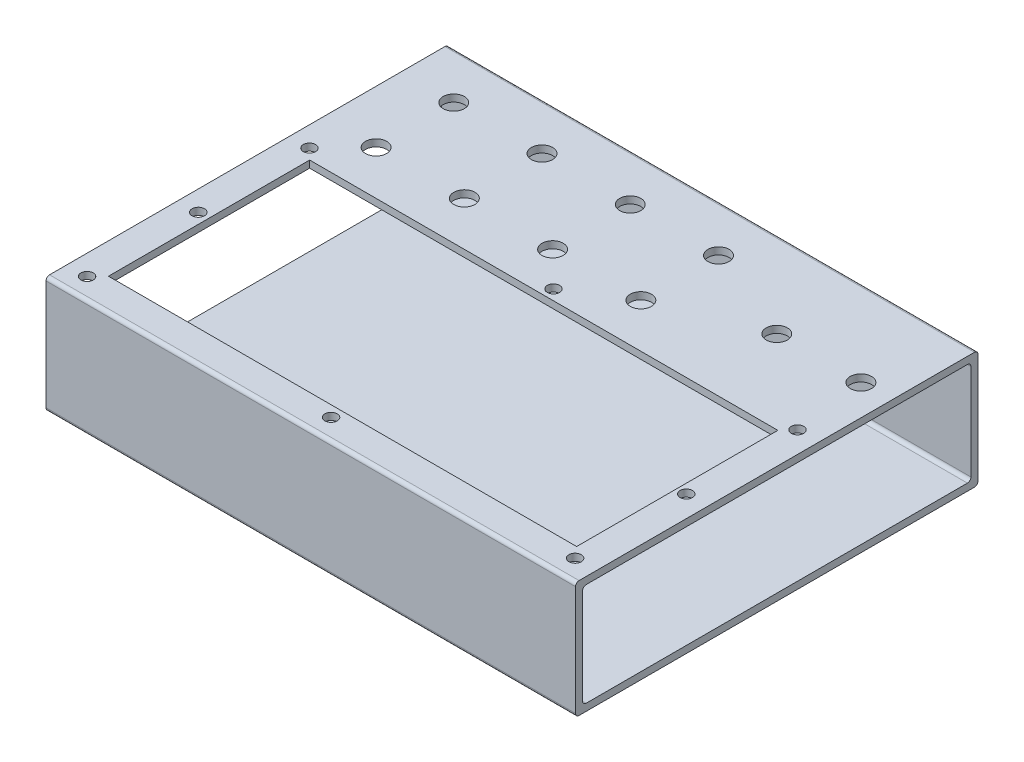
from build123d import *

# Parameters (mm, degrees)
BOSS_EXTRUDE7_DEPTH = 150
CUT_EXTRUDE3_DEPTH  = 150
SKETCH25_W          = 132.62
SKETCH25_H          = 57
CUT_EXTRUDE4_DEPTH  = 2
SKETCH26_R          = 3
SKETCH26_R_2        = 1.75
CUT_EXTRUDE5_DEPTH  = 10


with BuildPart() as part:
    # Sketch23 → Boss-Extrude7 (new body)
    with BuildSketch(Plane(origin=(0, 0, 0), x_dir=(0, 0, -1), z_dir=(1, 0, 0))):
        with BuildLine():
            Line((-56, 16.55), (56, 16.55))
            ThreePointArc((56, 16.55), (56.707106781, 16.257106781), (57, 15.55))
            Line((57, 15.55), (57, -15.55))
            ThreePointArc((57, -15.55), (56.707106781, -16.257106781), (56, -16.55))
            Line((56, -16.55), (-56, -16.55))
            ThreePointArc((-56, -16.55), (-56.707106781, -16.257106781), (-57, -15.55))
            Line((-57, -15.55), (-57, 15.55))
            ThreePointArc((-57, 15.55), (-56.707106781, 16.257106781), (-56, 16.55))
        make_face()
    extrude(amount=BOSS_EXTRUDE7_DEPTH)

    # Sketch24 → Cut-Extrude3 (cut)
    with BuildSketch(Plane.ZY):
        with BuildLine():
            Line((54, -14.55), (-54, -14.55))
            ThreePointArc((-54, -14.55), (-54.707106781, -14.257106781), (-55, -13.55))
            Line((-55, -13.55), (-55, 13.55))
            ThreePointArc((-55, 13.55), (-54.707106781, 14.257106781), (-54, 14.55))
            Line((-54, 14.55), (54, 14.55))
            ThreePointArc((54, 14.55), (54.707106781, 14.257106781), (55, 13.55))
            Line((55, 13.55), (55, -13.55))
            ThreePointArc((55, -13.55), (54.707106781, -14.257106781), (54, -14.55))
        make_face()
    extrude(amount=-CUT_EXTRUDE3_DEPTH, mode=Mode.SUBTRACT)

    # Sketch25 → Cut-Extrude4 (cut)
    with BuildSketch(Plane(origin=(0, 16.55, 0), x_dir=(1, 0, 0), z_dir=(0, 1, 0))):
        with Locations((75, -19.5)):
            Rectangle(SKETCH25_W, SKETCH25_H)
    extrude(amount=-CUT_EXTRUDE4_DEPTH, mode=Mode.SUBTRACT)

    # Sketch26 → Cut-Extrude5 (cut)
    with BuildSketch(Plane(origin=(0, 16.55, 0), x_dir=(1, 0, 0), z_dir=(0, 1, 0))):
        with Locations(Location((15, 43.5, 0), (0, 0, 270))):
            Circle(SKETCH26_R)
        with Locations(Location((15, 21.5, 0), (0, 0, 270))):
            Circle(SKETCH26_R)
        with Locations(Location((40, 43.5, 0), (0, 0, 270))):
            Circle(SKETCH26_R)
        with Locations(Location((40, 21.5, 0), (0, 0, 270))):
            Circle(SKETCH26_R)
        with Locations(Location((65, 43.5, 0), (0, 0, 270))):
            Circle(SKETCH26_R)
        with Locations(Location((65, 21.5, 0), (0, 0, 270))):
            Circle(SKETCH26_R)
        with Locations(Location((90, 43.5, 0), (0, 0, 270))):
            Circle(SKETCH26_R)
        with Locations(Location((90, 21.5, 0), (0, 0, 270))):
            Circle(SKETCH26_R)
        with Locations(Location((74.840255535, 11.91029543, 0), (0, 0, 270))):
            Circle(SKETCH26_R_2)
        with Locations(Location((5.720255535, 11.91029543, 0), (0, 0, 270))):
            Circle(SKETCH26_R_2)
        with Locations(Location((5.720255535, -19.58970457, 0), (0, 0, 270))):
            Circle(SKETCH26_R_2)
        with Locations(Location((5.720255535, -51.08970457, 0), (0, 0, 270))):
            Circle(SKETCH26_R_2)
        with Locations(Location((74.840255535, -51.08970457, 0), (0, 0, 270))):
            Circle(SKETCH26_R_2)
        with Locations(Location((143.960255535, -51.08970457, 0), (0, 0, 270))):
            Circle(SKETCH26_R_2)
        with Locations(Location((143.960255535, -19.58970457, 0), (0, 0, 270))):
            Circle(SKETCH26_R_2)
        with Locations(Location((143.960255535, 11.91029543, 0), (0, 0, 270))):
            Circle(SKETCH26_R_2)
        with Locations(Location((117.5, 32.5, 0), (0, 0, 270))):
            Circle(SKETCH26_R)
        with Locations(Location((141.333516057, 32.5, 0), (0, 0, 270))):
            Circle(SKETCH26_R)
    extrude(amount=-CUT_EXTRUDE5_DEPTH, mode=Mode.SUBTRACT)


solid = part.part
